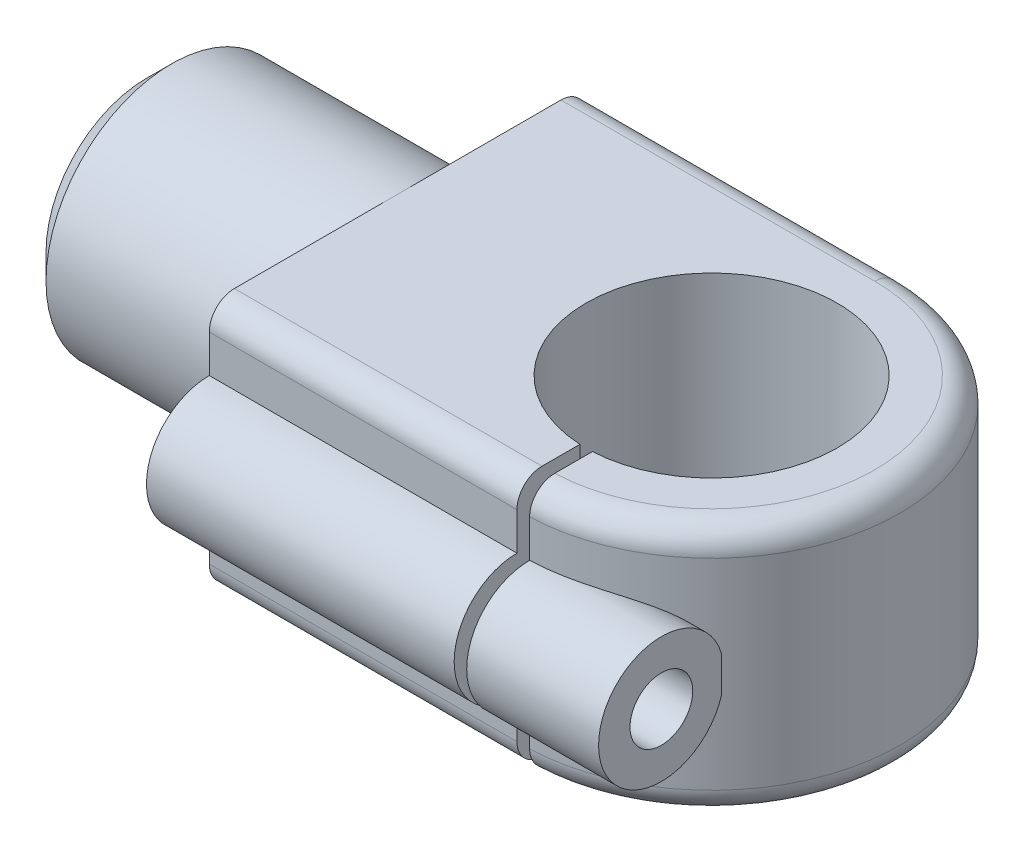
from build123d import *
from build123d.topology import SkipClean

# Parameters (mm, degrees)
BOSS_EXTRUDE1_DEPTH = 20
SKETCH2_R           = 5
BOSS_EXTRUDE2_DEPTH = 41
CUT_EXTRUDE1_DEPTH  = 41
SKETCH4_R           = 2.5
CUT_EXTRUDE2_DEPTH  = 31
FILLET1_R           = 2
SKETCH5_R           = 10
BOSS_EXTRUDE3_DEPTH = 15
CUT_EXTRUDE3_DEPTH  = 5
CHAMFER1_SIZE       = 2


with BuildPart() as part:
    # Sketch1 → Boss-Extrude1 (new body)
    with BuildSketch(Plane(origin=(0, 0, 0), x_dir=(1, 0, 0), z_dir=(0, 1, 0))):
        with BuildLine():
            ThreePointArc((0.5, -14.991664351), (14.997915943, 0.250034739), (0, 15))
            Line((0, 15), (-30, 15))
            Line((-30, 15), (-30, -15))
            Line((-30, -15), (-0.5, -15))
            Line((-0.5, -15), (-0.5, -9.987492178))
            ThreePointArc((-0.5, -9.987492178), (0, 10), (0.5, -9.987492178))
            Line((0.5, -9.987492178), (0.5, -14.991664351))
        make_face()
    extrude(amount=BOSS_EXTRUDE1_DEPTH)

    # Sketch2 → Boss-Extrude2 (add)
    with BuildSketch(Plane.ZY.offset(30)):
        with Locations(Location((15, 10, 0), (0, 0, 270))):
            Circle(SKETCH2_R)
    extrude(amount=-BOSS_EXTRUDE2_DEPTH)

    # Sketch3 → Cut-Extrude1 (cut)
    with BuildSketch(Plane(origin=(0, 20, 0), x_dir=(1, 0, 0), z_dir=(0, 1, 0))):
        Polygon((-0.5, -15), (-0.5, -9.987492178), (0.5, -9.987492178), (0.5, -14.991664351), (0.5, -20), (-0.5, -20), align=None)
    extrude(amount=-CUT_EXTRUDE1_DEPTH, mode=Mode.SUBTRACT)

    # Sketch4 → Cut-Extrude2 (cut)
    with BuildSketch(Plane(origin=(11, 0, 0), x_dir=(0, 0, -1), z_dir=(1, 0, 0))):
        with Locations((-15, 10)):
            Circle(SKETCH4_R)
    extrude(amount=-CUT_EXTRUDE2_DEPTH, mode=Mode.SUBTRACT)

    # Fillet1
    fillet1_edges = [part.edges().sort_by_distance(p)[0] for p in [
        (-15, 0, -15),
        (14.997915943, 0, -0.250034739),
        (-15, 20, -15),
        (-15.25, 20, 15),
        (14.997915943, 20, -0.250034739),
        (-15.25, 0, 15),
    ]]
    fillet(fillet1_edges, radius=FILLET1_R)

    # Sketch5 → Boss-Extrude3 (add)
    with BuildSketch(Plane.ZY.offset(30)):
        with Locations(Location((0, 10, 0), (0, 0, 270))):
            Circle(SKETCH5_R)
    extrude(amount=BOSS_EXTRUDE3_DEPTH)

    # Sketch6 → Cut-Extrude3 (cut)
    with SkipClean():  # the faces are left unmerged after this step: merging them gives an invalid solid
        with BuildSketch(Plane.ZY.offset(30)):
            with BuildLine():
                ThreePointArc((0, 0), (-10, 10), (0, 20))
                Line((0, 20), (-13, 20))
                ThreePointArc((-13, 20), (-14.414213562, 19.414213562), (-15, 18))
                Line((-15, 18), (-15, 2))
                ThreePointArc((-15, 2), (-14.414213562, 0.585786438), (-13, 0))
                Line((-13, 0), (0, 0))
            make_face()
            with BuildLine():
                Line((13, 20), (0, 20))
                ThreePointArc((0, 20), (10, 10), (0, 0))
                Line((0, 0), (13, 0))
                ThreePointArc((13, 0), (14.414213562, 0.585786438), (15, 2))
                Line((15, 2), (15, 5))
                ThreePointArc((15, 5), (20, 10), (15, 15))
                Line((15, 15), (15, 18))
                ThreePointArc((15, 18), (14.414213562, 19.414213562), (13, 20))
            make_face()
        extrude(amount=-CUT_EXTRUDE3_DEPTH, mode=Mode.SUBTRACT)

    # Chamfer1
    chamfer1_edges = [part.edges().sort_by_distance(p)[0] for p in [
        (-45, 20, 0),
    ]]
    chamfer(chamfer1_edges, length=CHAMFER1_SIZE)


solid = part.part
